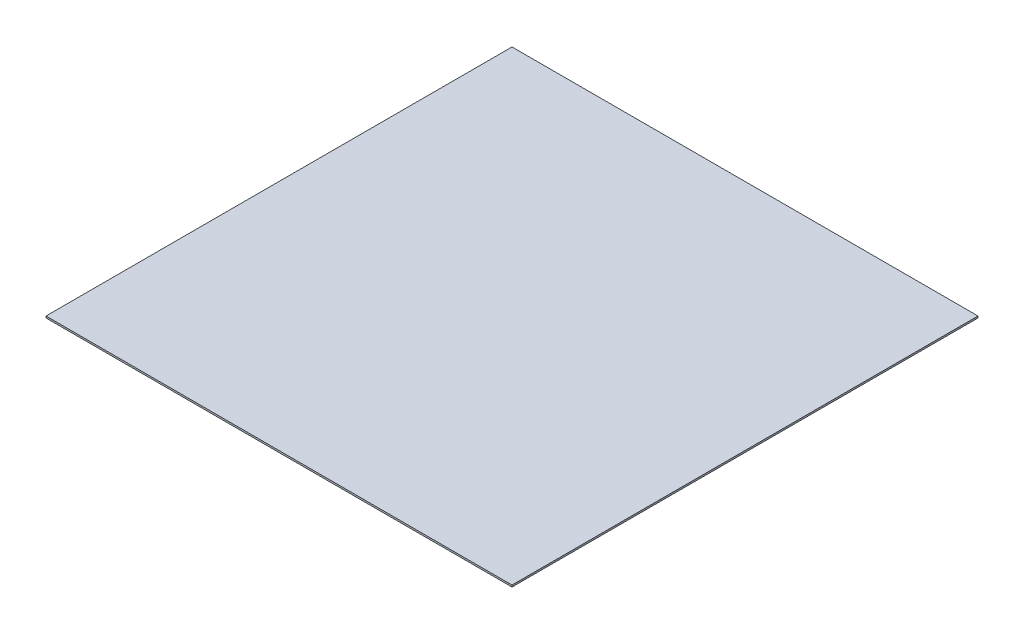
from build123d import *

# Parameters (mm, degrees)
SKETCH_1_W      = 800
SKETCH_1_H      = 800
EXTRUDE_1_DEPTH = 3


with BuildPart() as part:
    # 草图1 → 凸台-拉伸1 (new body)
    with BuildSketch(Plane(origin=(0, 0, 0), x_dir=(1, 0, 0), z_dir=(0, 1, 0))):
        Rectangle(SKETCH_1_W, SKETCH_1_H)
    extrude(amount=EXTRUDE_1_DEPTH)


solid = part.part
